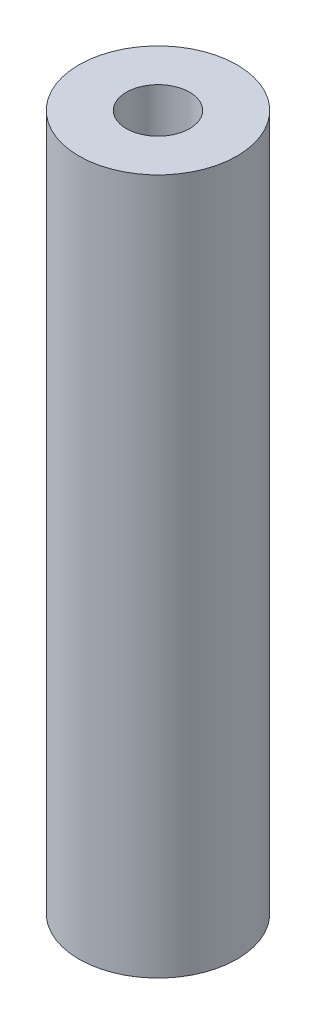
from build123d import *

# Parameters (mm, degrees)
SKETCH1_R           = 2.5
SKETCH1_R_2         = 1
BOSS_EXTRUDE1_DEPTH = 22


with BuildPart() as part:
    # Sketch1 → Boss-Extrude1 (new body)
    with BuildSketch(Plane(origin=(0, 0, 0), x_dir=(1, 0, 0), z_dir=(0, 1, 0))):
        with Locations(Location((0, 0, 0), (0, 0, 270))):
            Circle(SKETCH1_R)
        with Locations(Location((0, 0, 0), (0, 0, 270))):
            Circle(SKETCH1_R_2, mode=Mode.SUBTRACT)
    extrude(amount=BOSS_EXTRUDE1_DEPTH)


solid = part.part
